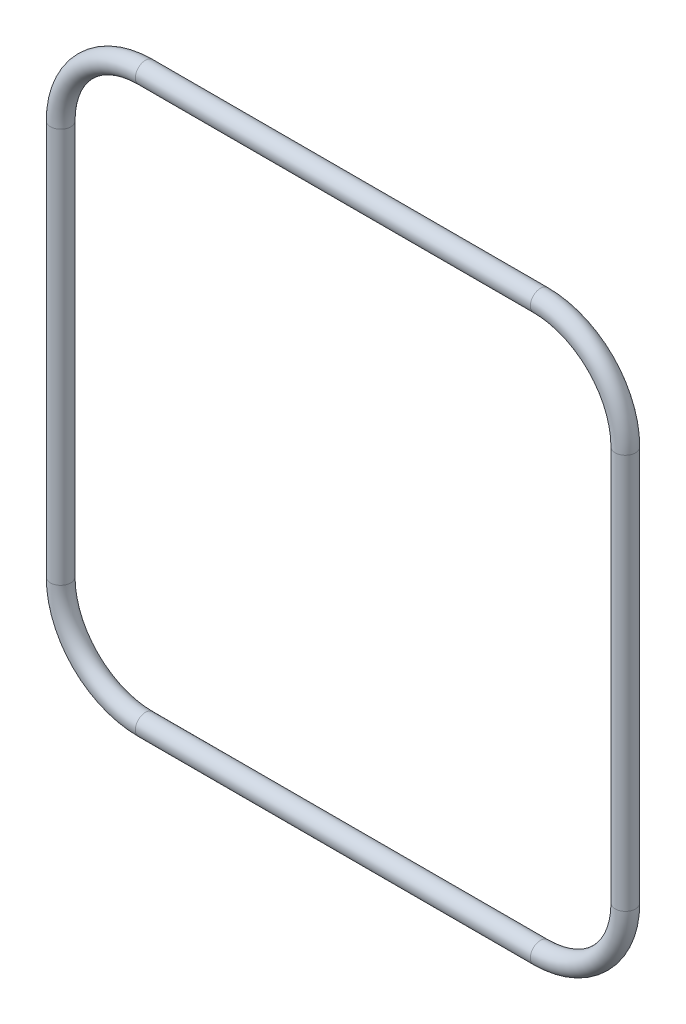
from build123d import *

# Parameters (mm, degrees)
SWEEP1_PROFILE_R = 1.65


with BuildPart() as part:
    # Sweep1: sweep along a path in Sketch1
    with BuildLine(Plane.XY) as sweep1_path:
        Line((4.249998297, 82.00000012), (4.249998297, 18.00000012))
        ThreePointArc((4.249998297, 18.00000012), (8.277280056, 8.277281879), (17.999998297, 4.25000012))
        Line((17.999998297, 4.25000012), (81.999998297, 4.25000012))
        ThreePointArc((81.999998297, 4.25000012), (91.722716538, 8.277281879), (95.749998297, 18.00000012))
        Line((95.749998297, 18.00000012), (95.749998297, 82.00000012))
        ThreePointArc((95.749998297, 82.00000012), (91.722716538, 91.722718361), (81.999998297, 95.75000012))
        Line((81.999998297, 95.75000012), (17.999998297, 95.75000012))
        ThreePointArc((17.999998297, 95.75000012), (8.277280056, 91.722718361), (4.249998297, 82.00000012))
    # Sweep1 profile (on start of the path) → Sweep1 (sweep)
    with BuildSketch(Plane(origin=(4.249998297, 82.00000012, 0), x_dir=(-1, 0, 0), z_dir=(0, -1, 0))):
        Circle(SWEEP1_PROFILE_R)
    sweep(path=sweep1_path.line)


solid = part.part
